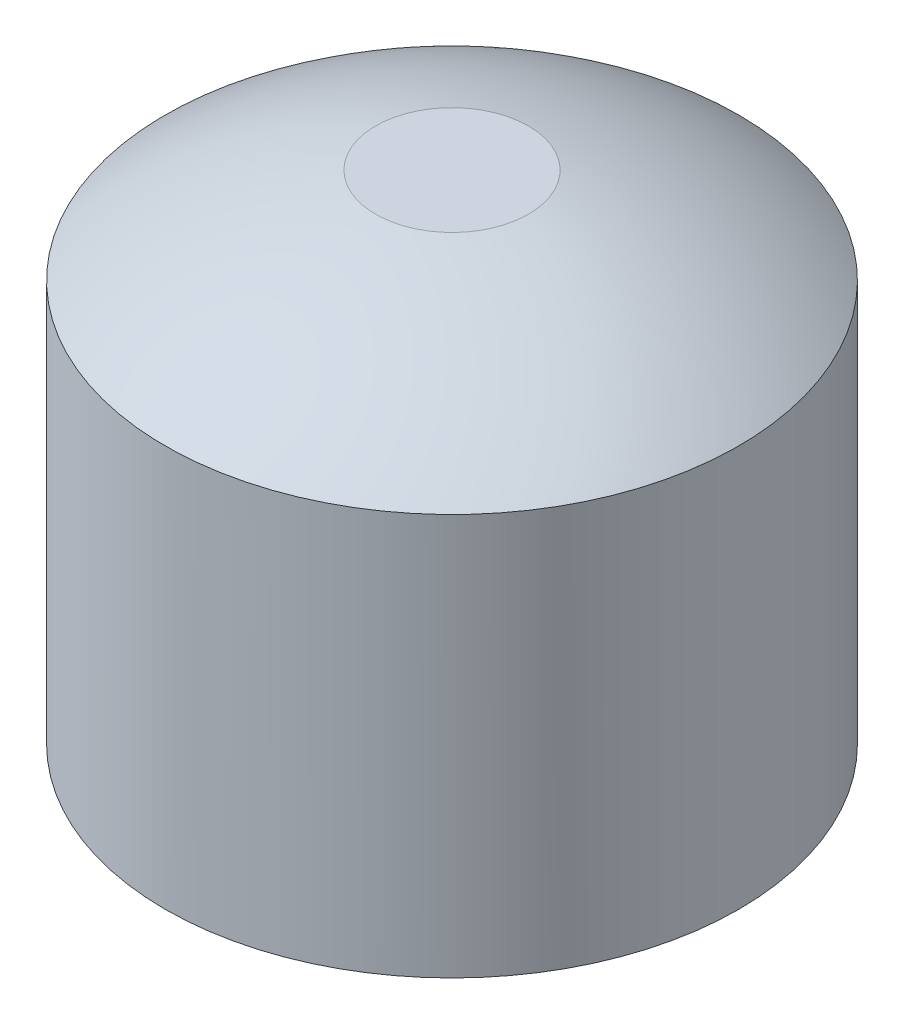
from build123d import *

# Parameters (mm, degrees)
SKETCH1_R           = 75
SKETCH1_R_2         = 70
BOSS_EXTRUDE1_DEPTH = 100


with BuildPart() as part:
    # Sketch1 → Boss-Extrude1 (new body)
    with BuildSketch(Plane(origin=(0, 0, 0), x_dir=(1, 0, 0), z_dir=(0, 1, 0))):
        with Locations(Location((0, 0, 0), (0, 0, 270))):
            Circle(SKETCH1_R)
        with Locations(Location((0, 0, 0), (0, 0, 270))):
            Circle(SKETCH1_R_2, mode=Mode.SUBTRACT)
    extrude(amount=BOSS_EXTRUDE1_DEPTH)

    # Sketch3 → Revolve1 (revolve)
    with BuildSketch(Plane(origin=(0, 0, 0), x_dir=(0, 0, -1), z_dir=(1, 0, 0)), mode=Mode.PRIVATE) as revolve1_sk:
        with BuildLine():
            Line((-70, 100), (-75, 100))
            Line((-75, 100), (-75, 105))
            add(Edge.make_bspline(
                [(-20, 130), (-50.667187392, 123.477390111), (-75, 105)],
                knots=[0, 0, 0, 1, 1, 1], degree=2))
            Line((-20, 130), (0, 130))
            Line((0, 130), (0, 122.928932188))
            Line((0, 122.928932188), (-20, 122.928932188))
            add(Edge.make_bspline(
                [(-20, 122.928932188), (-48.64448062, 117.780957156), (-70, 100)],
                knots=[0, 0, 0, 1, 1, 1], degree=2))
        make_face()
    revolve(revolve1_sk.sketch.rotate(Axis((0, -20.154872571, 0), (0, 1, 0)), 180), axis=Axis((0, -20.154872571, 0), (0, 1, 0)))


solid = part.part
